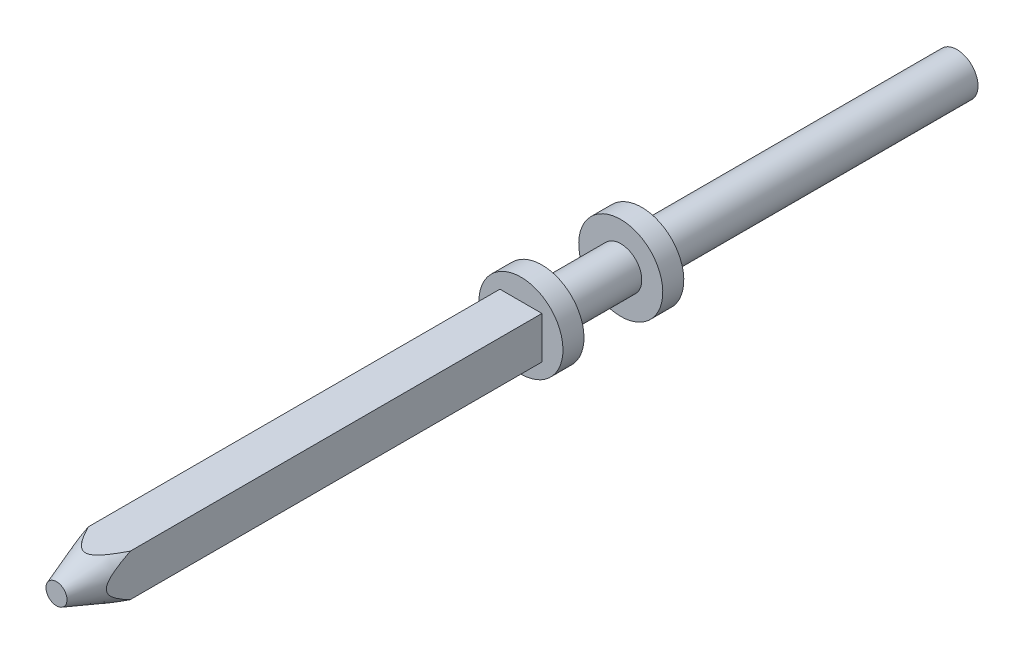
from build123d import *

# Parameters (mm, degrees)
ESQUISSE1_W             = 40
ESQUISSE1_H             = 40
BOSS_EXTRU_1_DEPTH      = 392
BOSS_EXTRU_2_START      = 50
ESQUISSE2_R             = 10
BOSS_EXTRU_2_DEPTH      = 50
BOSS_EXTRU_2_DRAFT      = 20
ENL_V_MAT_EXTRU_1_DEPTH = 398.882134636


with BuildPart() as part:
    # Esquisse1 → Boss.-Extru.1 (new body)
    with BuildSketch(Plane.XY):
        with Locations((20, 20)):
            Rectangle(ESQUISSE1_W, ESQUISSE1_H)
    extrude(amount=BOSS_EXTRU_1_DEPTH)


with BuildPart() as boss_extru_2_tool:
    # Esquisse2 → Boss.-Extru.2 (with draft: the straight prism first)
    with BuildSketch(Plane.XY.offset(392).offset(BOSS_EXTRU_2_START)):
        with Locations((20, 20)):
            Circle(ESQUISSE2_R)
    extrude(amount=-BOSS_EXTRU_2_DEPTH)
    # Boss.-Extru.2: the draft: its side faces are tilted about the plane it starts from
    boss_extru_2_sides = [boss_extru_2_tool.faces().sort_by_distance(p)[0] for p in [
        (10, 20, 417),
    ]]
    draft(boss_extru_2_sides, Plane.XY.offset(392).offset(BOSS_EXTRU_2_START), BOSS_EXTRU_2_DRAFT)


with BuildPart() as part_1:
    add(part.part)

    # Boss.-Extru.2: add boss_extru_2_tool
    add(boss_extru_2_tool.part)

    # Esquisse3 → Enlèv. mat.-Extru.1 (cut, through all)
    with BuildSketch(Plane(origin=(0, 0, 392), x_dir=(-1, 0, 0), z_dir=(0, 0, -1))):
        with BuildLine():
            ThreePointArc((-0.121467286, 40), (-20, 48.198511713), (-39.878532714, 40))
            Line((-39.878532714, 40), (-0.121467286, 40))
        make_face()
        with BuildLine():
            Line((-40, 0.121467286), (-40, 39.878532714))
            ThreePointArc((-40, 39.878532714), (-48.198511713, 20), (-40, 0.121467286))
        make_face()
        with BuildLine():
            ThreePointArc((0, 0.121467286), (8.198511713, 20), (0, 39.878532714))
            Line((0, 39.878532714), (0, 0.121467286))
        make_face()
        with BuildLine():
            Line((-0.121467286, 0), (-39.878532714, 0))
            ThreePointArc((-39.878532714, 0), (-20, -8.198511713), (-0.121467286, 0))
        make_face()
    extrude(amount=-ENL_V_MAT_EXTRU_1_DEPTH, mode=Mode.SUBTRACT)

    # Esquisse5 → Révolution1 (revolve)
    with BuildSketch(Plane(origin=(20, 0, 0), x_dir=(0, 0, -1), z_dir=(1, 0, 0))):
        Polygon((0, 40), (0, 60), (20, 60), (20, 40), (95, 40), (95, 60), (115, 60), (115, 40), (415, 40), (415, 20), (0, 20), align=None)
    revolve(axis=Axis((20, 20, 0), (0, 0, -1)))


solid = part_1.part
